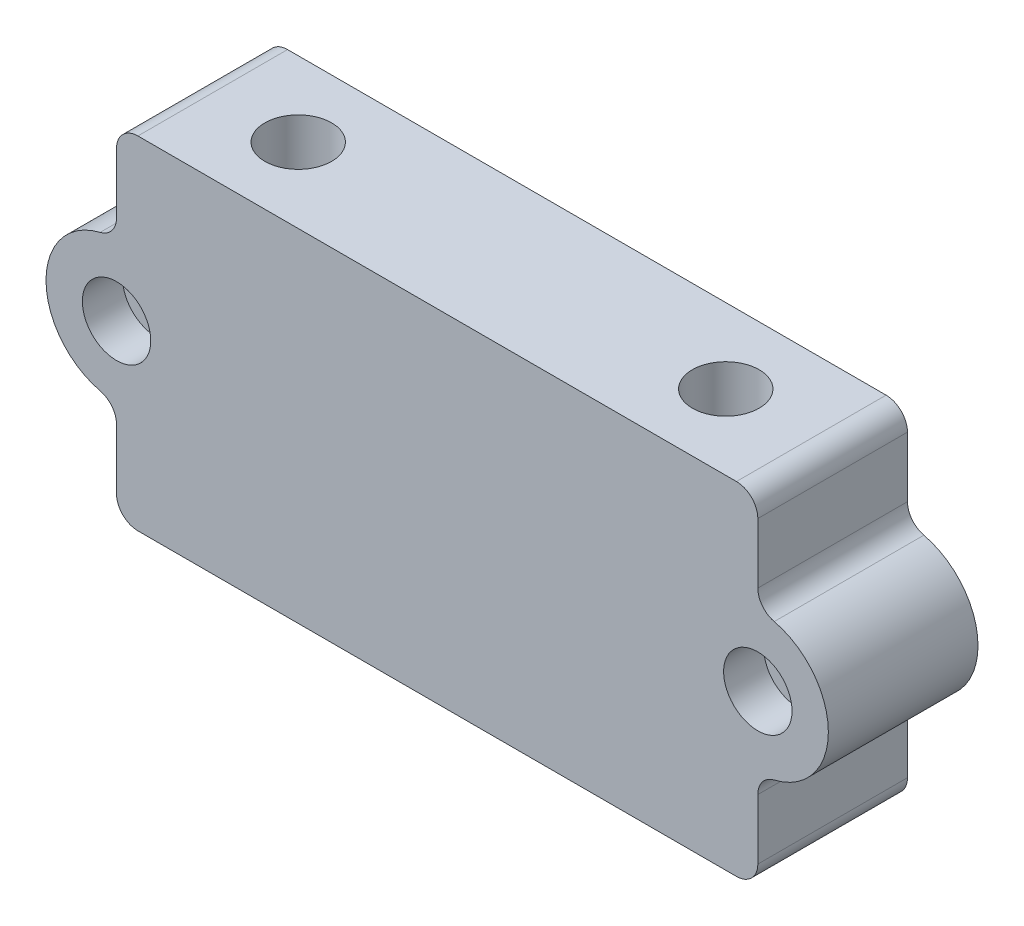
from build123d import *

# Parameters (mm, degrees)
SKETCH1_W           = 93.6625
SKETCH1_H           = 40.64
SKETCH1_R           = 2.4892
BOSS_EXTRUDE1_DEPTH = 17.78
SKETCH6_R           = 3.96875
CUT_EXTRUDE4_DEPTH  = 104.635910312
CUT_EXTRUDE3_DEPTH  = 17.78
FILLET1_R           = 2.54
SKETCH3_R           = 4.064
CUT_EXTRUDE5_DEPTH  = 4.7752


with BuildPart() as part:
    # Sketch1 → Boss-Extrude1 (new body)
    with BuildSketch(Plane.XY):
        with Locations((-46.83125, 0)):
            Rectangle(SKETCH1_W, SKETCH1_H)
        with Locations((-84.93125, 0)):
            Circle(SKETCH1_R, mode=Mode.SUBTRACT)
        with Locations((-8.73125, 0)):
            Circle(SKETCH1_R, mode=Mode.SUBTRACT)
    extrude(amount=-BOSS_EXTRUDE1_DEPTH)

    # Sketch6 → Cut-Extrude4 (cut, through all)
    with BuildSketch(Plane(origin=(0, 20.32, 0), x_dir=(1, 0, 0), z_dir=(0, 1, 0))):
        with Locations(Location((-72.23125, 8.89, 0), (0, 0, 270))):
            Circle(SKETCH6_R)
        with Locations(Location((-21.43125, 8.89, 0), (0, 0, 270))):
            Circle(SKETCH6_R)
    extrude(amount=-CUT_EXTRUDE4_DEPTH, mode=Mode.SUBTRACT)

    # Sketch5 → Cut-Extrude3 (cut)
    with BuildSketch(Plane.XY):
        with BuildLine():
            Line((-93.6625, -20.32), (-93.6625, 20.32))
            Line((-93.6625, 20.32), (-84.93125, 20.32))
            Line((-84.93125, 20.32), (-84.93125, 10.622546022))
            ThreePointArc((-84.93125, 10.622546022), (-85.477262526, 9.049137635), (-86.880552326, 8.152186482))
            ThreePointArc((-86.880552326, 8.152186482), (-93.31325, 0), (-86.880552326, -8.152186482))
            ThreePointArc((-86.880552326, -8.152186482), (-85.477262526, -9.049137635), (-84.93125, -10.622546022))
            Line((-84.93125, -10.622546022), (-84.93125, -20.32))
            Line((-84.93125, -20.32), (-93.6625, -20.32))
        make_face()
        with BuildLine():
            Line((0, -20.32), (0, 20.32))
            Line((0, 20.32), (-8.73125, 20.32))
            Line((-8.73125, 20.32), (-8.73125, 10.622546022))
            ThreePointArc((-8.73125, 10.622546022), (-8.185237474, 9.049137635), (-6.781947674, 8.152186482))
            ThreePointArc((-6.781947674, 8.152186482), (-0.34925, 0), (-6.781947674, -8.152186482))
            ThreePointArc((-6.781947674, -8.152186482), (-8.185237474, -9.049137635), (-8.73125, -10.622546022))
            Line((-8.73125, -10.622546022), (-8.73125, -20.32))
            Line((-8.73125, -20.32), (0, -20.32))
        make_face()
    extrude(amount=-CUT_EXTRUDE3_DEPTH, mode=Mode.SUBTRACT)

    # Fillet1
    fillet1_edges = [part.edges().sort_by_distance(p)[0] for p in [
        (-84.93125, 20.32, -8.89),
        (-84.93125, -20.32, -8.89),
        (-8.73125, 20.32, -8.89),
        (-8.73125, -20.32, -8.89),
    ]]
    fillet(fillet1_edges, radius=FILLET1_R)

    # Sketch3 → Cut-Extrude5 (cut)
    with BuildSketch(Plane.XY):
        with Locations((-84.93125, 0)):
            Circle(SKETCH3_R)
        with Locations((-8.73125, 0)):
            Circle(SKETCH3_R)
    extrude(amount=-CUT_EXTRUDE5_DEPTH, mode=Mode.SUBTRACT)


solid = part.part
